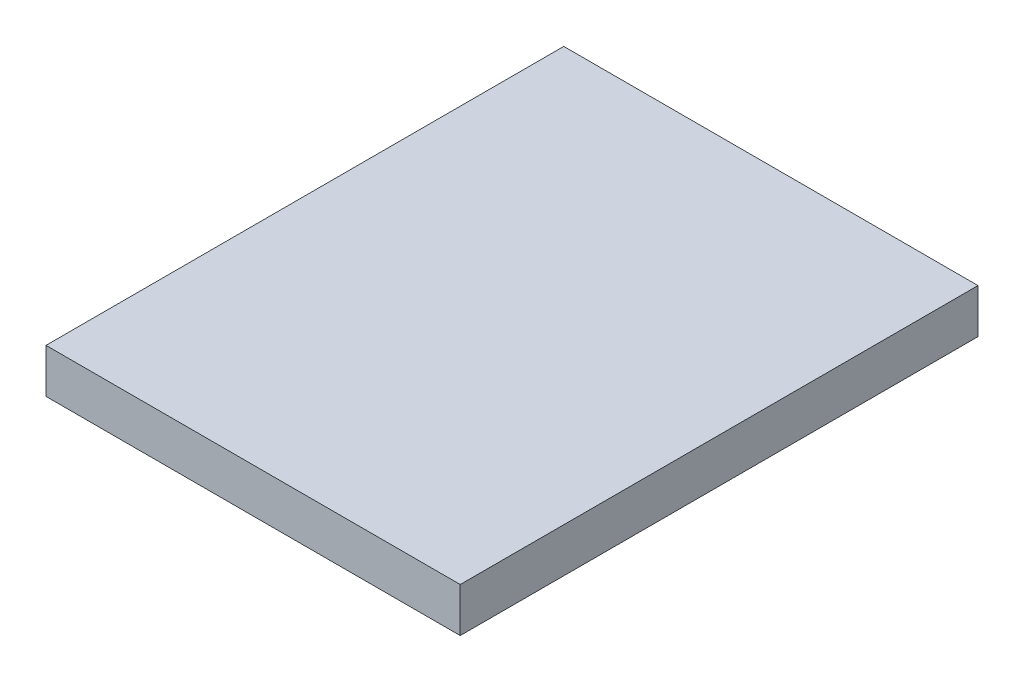
from build123d import *

# Parameters (mm, degrees)
SKETCH2_W           = 44
SKETCH2_H           = 55
BOSS_EXTRUDE1_DEPTH = 4.7


with BuildPart() as part:
    # Sketch2 → Boss-Extrude1 (new body)
    with BuildSketch(Plane(origin=(0, 0, 0), x_dir=(1, 0, 0), z_dir=(0, 1, 0))):
        Rectangle(SKETCH2_W, SKETCH2_H)
    extrude(amount=BOSS_EXTRUDE1_DEPTH)


solid = part.part
